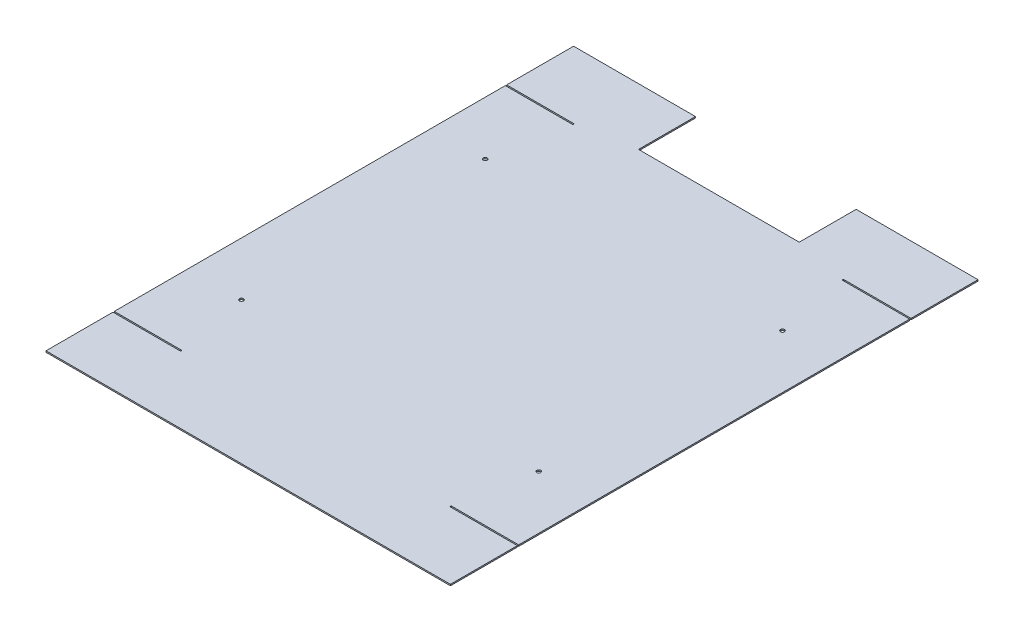
from build123d import *

# Parameters (mm, degrees)
SKETCH1_W               = 302
SKETCH1_H               = 394
BOSS_EXTRUDE1_DEPTH     = 1
CUT_EXTRUDE2_DEPTH      = 249.215632062
MIRROR2_COPY_1_DEPTH    = 249.215632062
SKETCH4_R               = 1.5
CUT_EXTRUDE3_DEPTH      = 249.215632062
MIRROR4_COPY_1_SKETCH_R = 1.5
MIRROR4_COPY_1_DEPTH    = 249.215632062
SKETCH5_W               = 120
SKETCH5_H               = 42.5
CUT_EXTRUDE4_DEPTH      = 249.215632062


with BuildPart() as part:
    # Sketch1 → Boss-Extrude1 (new body)
    with BuildSketch(Plane(origin=(0, 0, 0), x_dir=(1, 0, 0), z_dir=(0, 1, 0))):
        Rectangle(SKETCH1_W, SKETCH1_H)
    extrude(amount=BOSS_EXTRUDE1_DEPTH)

    # Sketch3 → Cut-Extrude2 (cut, through all)
    with BuildSketch(Plane(origin=(0, 1, 0), x_dir=(1, 0, 0), z_dir=(0, 1, 0))):
        with BuildLine():
            Line((-151, 147), (-101, 147))
            ThreePointArc((-101, 147), (-100.5, 146.5), (-101, 146))
            Line((-101, 146), (-151, 146))
            ThreePointArc((-151, 146), (-151.5, 146.5), (-151, 147))
        make_face()
    cut_extrude2 = extrude(amount=-CUT_EXTRUDE2_DEPTH, mode=Mode.SUBTRACT)

    # Mirror1: Cut-Extrude2 across plane
    add(cut_extrude2.mirror(Plane.XY), mode=Mode.SUBTRACT)

    # Mirror2: Cut-Extrude2 across plane
    add(cut_extrude2.mirror(Plane(origin=(0, 0, 0), x_dir=(0, 0, 1), z_dir=(1, 0, 0))), mode=Mode.SUBTRACT)

    # Mirror2 copy 1 sketch → Mirror2 copy 1 (cut, through all)
    with BuildSketch(Plane(origin=(0, 1, 0), x_dir=(-1, 0, 0), z_dir=(0, 1, 0))):
        with BuildLine():
            Line((-151, 147), (-101, 147))
            ThreePointArc((-101, 147), (-100.5, 146.5), (-101, 146))
            Line((-101, 146), (-151, 146))
            ThreePointArc((-151, 146), (-151.5, 146.5), (-151, 147))
        make_face()
    extrude(amount=-MIRROR2_COPY_1_DEPTH, mode=Mode.SUBTRACT)

    # Sketch4 → Cut-Extrude3 (cut, through all)
    with BuildSketch(Plane(origin=(0, 1, 0), x_dir=(1, 0, 0), z_dir=(0, 1, 0))):
        with Locations(Location((-111, 91, 0), (0, 0, 270))):
            Circle(SKETCH4_R)
    cut_extrude3 = extrude(amount=-CUT_EXTRUDE3_DEPTH, mode=Mode.SUBTRACT)

    # Mirror3: Cut-Extrude3 across plane
    add(cut_extrude3.mirror(Plane(origin=(0, 0, 0), x_dir=(0, 0, 1), z_dir=(1, 0, 0))), mode=Mode.SUBTRACT)

    # Mirror4: Cut-Extrude3 across plane
    add(cut_extrude3.mirror(Plane.XY), mode=Mode.SUBTRACT)

    # Mirror4 copy 1 sketch → Mirror4 copy 1 (cut, through all)
    with BuildSketch(Plane(origin=(0, 1, 0), x_dir=(-1, 0, 0), z_dir=(0, 1, 0))):
        with Locations(Location((-111, 91, 0), (0, 0, 270))):
            Circle(MIRROR4_COPY_1_SKETCH_R)
    extrude(amount=-MIRROR4_COPY_1_DEPTH, mode=Mode.SUBTRACT)

    # Sketch5 → Cut-Extrude4 (cut, through all)
    with BuildSketch(Plane(origin=(0, 1, 0), x_dir=(1, 0, 0), z_dir=(0, 1, 0))):
        with Locations((0, 175.75)):
            Rectangle(SKETCH5_W, SKETCH5_H)
    extrude(amount=-CUT_EXTRUDE4_DEPTH, mode=Mode.SUBTRACT)


solid = part.part
